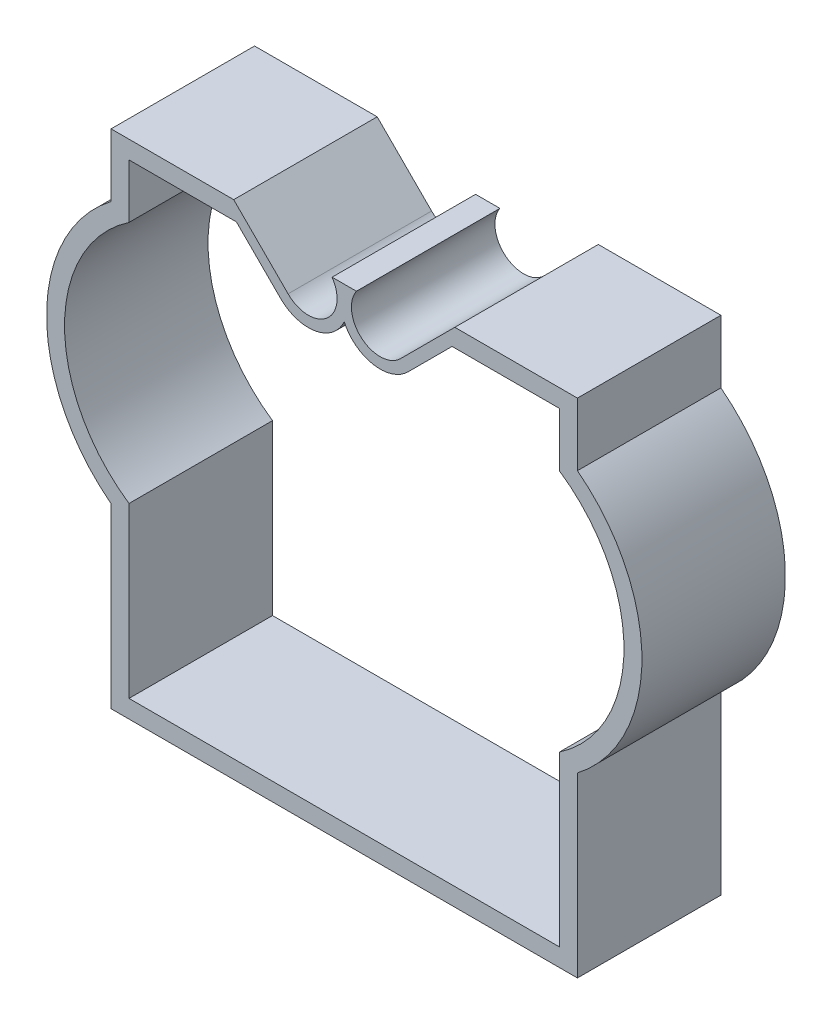
from build123d import *

# Parameters (mm, degrees)
AUFSATZ_LINEAR_AUSTRAGEN1_DEPTH = 20


with BuildPart() as part:
    # Skizze1 → Aufsatz-Linear austragen1 (new body)
    with BuildSketch(Plane.XY):
        with BuildLine():
            ThreePointArc((32.5, -10.246334318), (41.488350442, 7.993009877), (32.5, 26.232354072))
            Line((32.5, 26.232354072), (32.5, 35))
            Line((32.5, 35), (15.409785503, 35))
            Line((15.409785503, 35), (7.828556273, 27.418770769))
            ThreePointArc((7.828556273, 27.41877077), (2.44835133, 27.166868372), (1.69484812, 32.5))
            Line((1.69484812, 32.5), (-1.69484812, 32.5))
            ThreePointArc((-1.69484812, 32.5), (-2.44835133, 27.166868372), (-7.828556273, 27.41877077))
            Line((-7.828556273, 27.418770769), (-15.409785503, 35))
            Line((-15.409785503, 35), (-32.5, 35))
            Line((-32.5, 35), (-32.5, 26.232354072))
            ThreePointArc((-32.5, 26.232354072), (-41.488350442, 7.993009877), (-32.5, -10.246334318))
            Line((-32.5, -10.246334318), (-32.5, -35))
            Line((-32.5, -35), (32.5, -35))
            Line((32.5, -35), (32.5, -10.246334318))
        make_face()
        with BuildLine():
            Line((30, 32.5), (30, 24.955672535))
            ThreePointArc((30, 24.955672535), (38.988350442, 7.993009877), (30, -8.969652782))
            Line((30, -8.969652782), (30, -32.5))
            Line((30, -32.5), (-30, -32.5))
            Line((-30, -32.5), (-30, -8.969652782))
            ThreePointArc((-30, -8.969652782), (-38.988350442, 7.993009877), (-30, 24.955672535))
            Line((-30, 24.955672535), (-30, 32.5))
            Line((-30, 32.5), (-15.031105847, 32.5))
            Line((-15.031105847, 32.5), (-8.889216445, 26.358110598))
            ThreePointArc((-8.889216445, 26.358110598), (-4.026954213, 24.833979762), (0, 27.956191892))
            ThreePointArc((0, 27.956191892), (4.026954213, 24.833979762), (8.889216445, 26.358110598))
            Line((8.889216445, 26.358110598), (15.031105847, 32.5))
            Line((15.031105847, 32.5), (30, 32.5))
        make_face(mode=Mode.SUBTRACT)
    extrude(amount=AUFSATZ_LINEAR_AUSTRAGEN1_DEPTH)


solid = part.part
